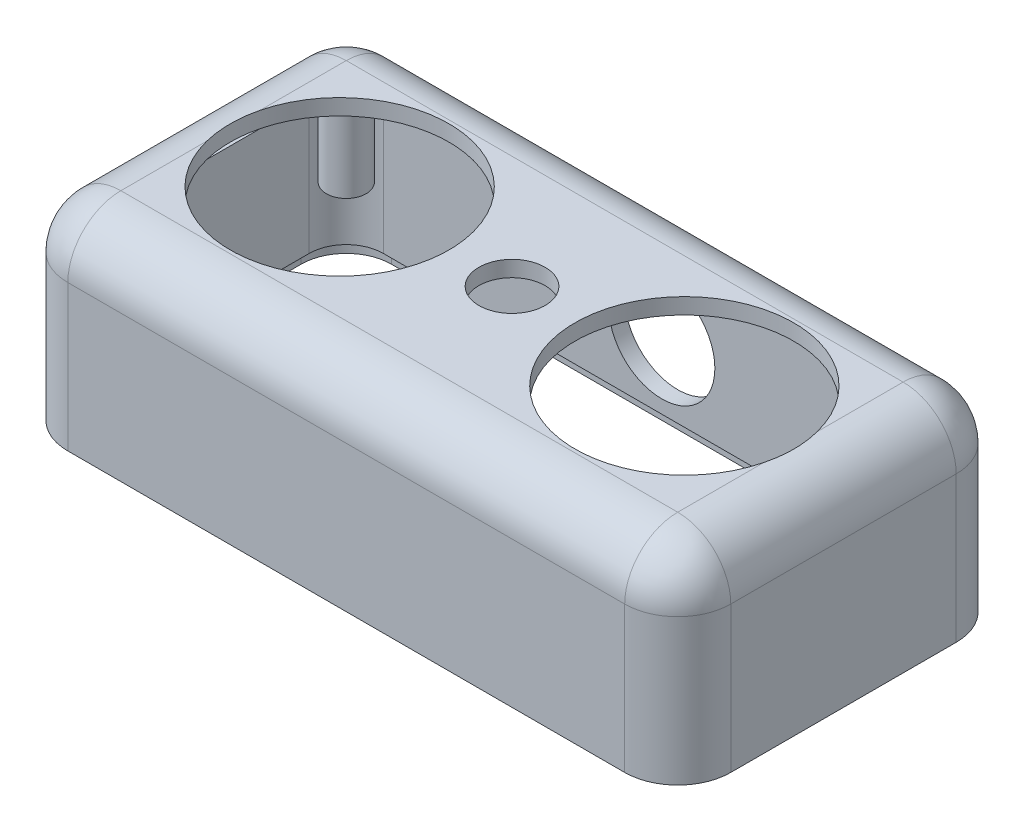
from build123d import *

# Parameters (mm, degrees)
SKETCH1_W           = 50
SKETCH1_H           = 25
BOSS_EXTRUDE2_DEPTH = 15
FILLET1_R           = 4
FILLET2_R           = 4
SHELL1_T            = -1.2
SKETCH2_R           = 8.25
CUT_EXTRUDE1_DEPTH  = 58.579857589
SKETCH3_R           = 1.5
BOSS_EXTRUDE3_DEPTH = 7
SKETCH6_R           = 0.5
CUT_EXTRUDE3_DEPTH  = 3
CUT_EXTRUDE6_DEPTH  = 1
SKETCH9_R           = 4
CUT_EXTRUDE15_DEPTH = 1.2
SKETCH13_R          = 2.5
CUT_EXTRUDE16_DEPTH = 58.579857676


with BuildPart() as part:
    # Sketch1 → Boss-Extrude2 (new body)
    with BuildSketch(Plane(origin=(0, 0, 0), x_dir=(1, 0, 0), z_dir=(0, 1, 0))):
        with Locations((25, 12.5)):
            Rectangle(SKETCH1_W, SKETCH1_H)
    extrude(amount=BOSS_EXTRUDE2_DEPTH)

    # Fillet1
    fillet1_edges = [part.edges().sort_by_distance(p)[0] for p in [
        (0, 7.5, -25),
        (50, 7.5, -25),
        (50, 7.5, 0),
        (0, 7.5, 0),
    ]]
    fillet(fillet1_edges, radius=FILLET1_R)

    # Fillet2
    fillet2_edges = [part.edges().sort_by_distance(p)[0] for p in [
        (50, 15, -12.5),
        (25, 15, 0),
        (0, 15, -12.5),
        (25, 15, -25),
        (48.828427125, 15, -23.828427125),
        (1.171572875, 15, -23.828427125),
        (1.171572875, 15, -1.171572875),
        (48.828427125, 15, -1.171572875),
    ]]
    fillet(fillet2_edges, radius=FILLET2_R)

    # Shell1
    shell1_openings = [part.faces().sort_by_distance(p)[0] for p in [
        (25, 0, -12.5),
    ]]
    offset(amount=SHELL1_T, openings=shell1_openings, kind=Kind.INTERSECTION)

    # Sketch2 → Cut-Extrude1 (cut, through all)
    with BuildSketch(Plane.XZ.offset(-13.8)):
        with Locations(Location((38, -12.5, 0), (0, 0, 345.858889766))):
            Circle(SKETCH2_R)
        with Locations(Location((12, -12.5, 0), (0, 0, 194.141110234))):
            Circle(SKETCH2_R)
    extrude(amount=-CUT_EXTRUDE1_DEPTH, mode=Mode.SUBTRACT)

    # Sketch3 → Boss-Extrude3 (add)
    with BuildSketch(Plane.XZ.offset(-13.8)):
        with Locations(Location((46.25, -21.25, 0), (0, 0, 99.594068224))):
            Circle(SKETCH3_R)
        with Locations(Location((3.75, -21.25, 0), (0, 0, 80.405931773))):
            Circle(SKETCH3_R)
        with Locations(Location((3.75, -3.75, 0), (0, 0, 80.405943008))):
            Circle(SKETCH3_R)
        with Locations(Location((46.25, -3.75, 0), (0, 0, 99.594068235))):
            Circle(SKETCH3_R)
    extrude(amount=BOSS_EXTRUDE3_DEPTH)

    # Sketch6 → Cut-Extrude3 (cut)
    with BuildSketch(Plane.XZ.offset(-6.8)):
        with Locations(Location((46.25, -3.75, 0), (0, 0, 270))):
            Circle(SKETCH6_R)
        with Locations(Location((46.25, -21.25, 0), (0, 0, 270))):
            Circle(SKETCH6_R)
        with Locations(Location((3.75, -21.25, 0), (0, 0, 270))):
            Circle(SKETCH6_R)
        with Locations(Location((3.75, -3.75, 0), (0, 0, 270))):
            Circle(SKETCH6_R)
    extrude(amount=-CUT_EXTRUDE3_DEPTH, mode=Mode.SUBTRACT)

    # Sketch8 → Cut-Extrude6 (cut)
    with BuildSketch(Plane.XZ):
        with BuildLine():
            Line((0.6, -4), (0.6, -21))
            ThreePointArc((0.6, -21), (1.595836944, -23.404163056), (4, -24.4))
            Line((4, -24.4), (46, -24.4))
            ThreePointArc((46, -24.4), (48.404163056, -23.404163056), (49.4, -21))
            Line((49.4, -21), (49.4, -4))
            ThreePointArc((49.4, -4), (48.404163056, -1.595836944), (46, -0.6))
            Line((46, -0.6), (4, -0.6))
            ThreePointArc((4, -0.6), (1.595836944, -1.595836944), (0.6, -4))
        make_face()
    extrude(amount=-CUT_EXTRUDE6_DEPTH, mode=Mode.SUBTRACT)

    # Sketch9 → Cut-Extrude15 (cut)
    with BuildSketch(Plane(origin=(0, 0, -25), x_dir=(-1, 0, 0), z_dir=(0, 0, -1))):
        with Locations((-25, 6)):
            Circle(SKETCH9_R)
    extrude(amount=-CUT_EXTRUDE15_DEPTH, mode=Mode.SUBTRACT)

    # Sketch13 → Cut-Extrude16 (cut, through all)
    with BuildSketch(Plane.XZ.offset(-13.8)):
        with Locations(Location((25, -12.5, 0), (0, 0, 270))):
            Circle(SKETCH13_R)
    extrude(amount=-CUT_EXTRUDE16_DEPTH, mode=Mode.SUBTRACT)


solid = part.part
